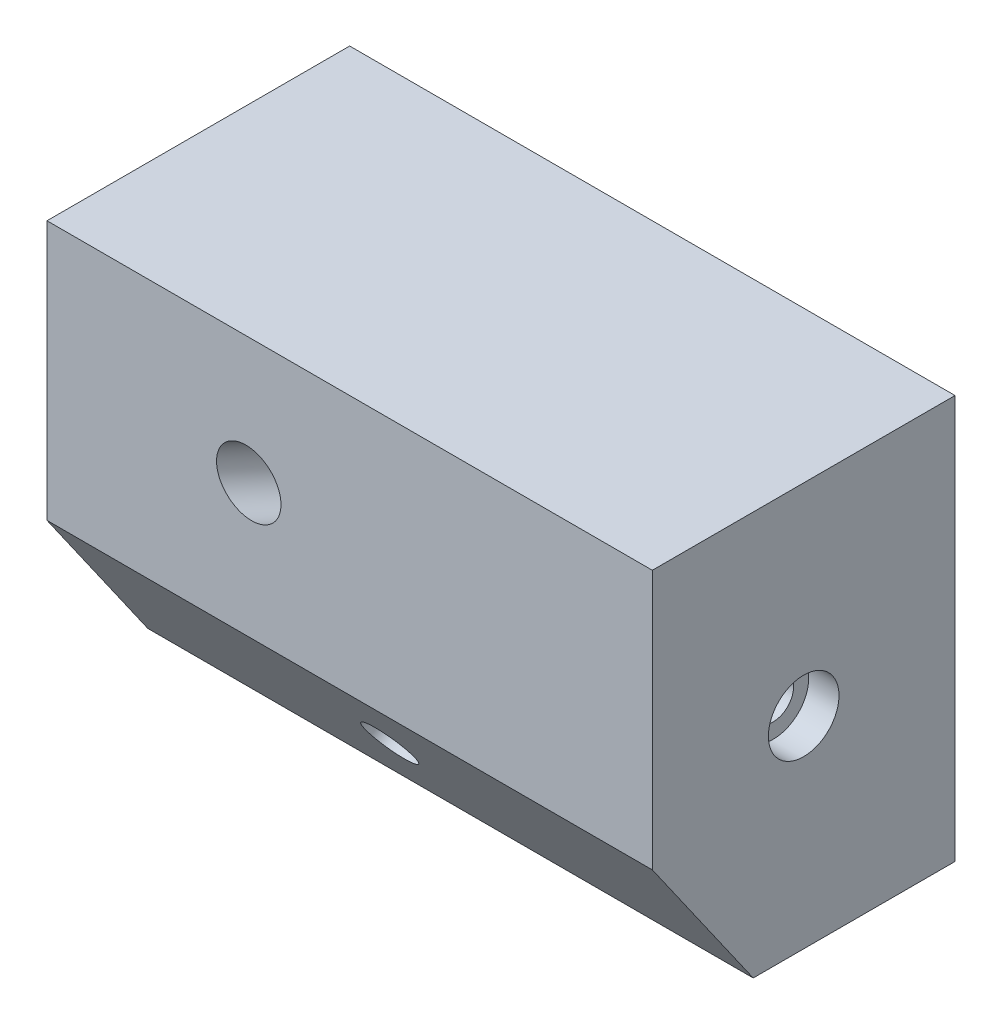
from build123d import *

# Parameters (mm, degrees)
SKETCH_1_W          = 120
SKETCH_1_H          = 80
EXTRUDE_1_DEPTH     = 60
CUT_EXTRUDE_1_DEPTH = 157.204993518
SWEEP_2_PROFILE_R   = 6
CUT_EXTRUDE_2_DEPTH = 3.602159411
CUT_EXTRUDE_2_DRAFT = -59
SKETCH_5_R          = 7
CUT_EXTRUDE_3_DEPTH = 6
SKETCH_6_R          = 4
CUT_EXTRUDE_4_DEPTH = 50
SWEEP_4_PROFILE_R   = 5


with BuildPart() as part:
    # 草图1 → 凸台-拉伸1 (new body)
    with BuildSketch(Plane.XY):
        with Locations((60, 40)):
            Rectangle(SKETCH_1_W, SKETCH_1_H)
    extrude(amount=EXTRUDE_1_DEPTH)

    # 草图2 → 切除-拉伸1 (cut, through all)
    with BuildSketch(Plane(origin=(0, 0, 0), x_dir=(0, 0, -1), z_dir=(1, 0, 0))):
        Polygon((-40, 0), (-60, 0), (-60, 28.56287), align=None)
    extrude(amount=CUT_EXTRUDE_1_DEPTH, mode=Mode.SUBTRACT)

    # 切除-扫描2: sweep along a curve in space
    with BuildLine() as sweep_2_path:
        Line((36.683319, 57.441689, 69.112507), (58.926443, 41.066649, 8.000026))
    # 切除-扫描2 profile (on start of the path) → 切除-扫描2 (sweep, cut)
    with BuildSketch(Plane(origin=(36.683319, 57.441689, 69.112507), x_dir=(-0.9396926209151826, 0, -0.34202014297049077), z_dir=(0.3316681247446686, -0.24416888605300846, -0.9112506845605045))):
        Circle(SWEEP_2_PROFILE_R)
    sweep(path=sweep_2_path.line, mode=Mode.SUBTRACT)


with BuildPart() as cut_extrude_2_tool:
    # 草图4 → 切除-拉伸2 (with draft: the straight prism first)
    with BuildSketch(Plane(origin=(0.738557167, -0.543714235, -2.029169141), x_dir=(0.9433961283725703, 0.08584202767282707, 0.3203668073578514), z_dir=(-0.3316681247446686, 0.2441688860530088, 0.9112506845605044))):
        with BuildLine():
            ThreePointArc((61.679165391, 31.596777759), (67.679165393, 37.596777757), (61.679165395, 43.596777759))
            ThreePointArc((61.679165395, 43.596777759), (55.679165393, 37.596777761), (61.679165391, 31.596777759))
        make_face()
    extrude(amount=-CUT_EXTRUDE_2_DEPTH)
    # 切除-拉伸2: the draft: its side faces are tilted about the plane it starts from
    cut_extrude_2_sides = [cut_extrude_2_tool.faces().sort_by_distance(p)[0] for p in [
        (59.523803726, 34.831326418, 7.911705161),
    ]]
    draft(cut_extrude_2_sides, Plane(origin=(0.738557167, -0.543714235, -2.029169141), x_dir=(0.9433961283725703, 0.08584202767282707, 0.3203668073578514), z_dir=(-0.3316681247446686, 0.2441688860530088, 0.9112506845605044)), CUT_EXTRUDE_2_DRAFT)


with BuildPart() as part_1:
    add(part.part)

    # 切除-拉伸2: cut by cut_extrude_2_tool
    add(cut_extrude_2_tool.part, mode=Mode.SUBTRACT)

    # 草图5 → 切除-拉伸3 (cut)
    with BuildSketch(Plane(origin=(120, 0, 0), x_dir=(0, 0, -1), z_dir=(1, 0, 0))):
        with Locations((-30, 40)):
            Circle(SKETCH_5_R)
    extrude(amount=-CUT_EXTRUDE_3_DEPTH, mode=Mode.SUBTRACT)

    # 草图6 → 切除-拉伸4 (cut)
    with BuildSketch(Plane(origin=(120, 0, 0), x_dir=(0, 0, -1), z_dir=(1, 0, 0))):
        with Locations((-30, 40)):
            Circle(SKETCH_6_R)
    extrude(amount=-CUT_EXTRUDE_4_DEPTH, mode=Mode.SUBTRACT)

    # 切除-扫描4: sweep along a curve in space
    with BuildLine() as sweep_4_path:
        Line((57.9403, 8.545716, 58.19152), (57.9403, 41.792672, 10.709946))
    # 切除-扫描4 profile (on start of the path) → 切除-扫描4 (sweep, cut)
    with BuildSketch(Plane(origin=(57.9403, 8.545716, 58.19152), x_dir=(0, -0.8191520446202117, -0.573576435878015), z_dir=(0, 0.573576435878015, -0.8191520446202117))):
        Circle(SWEEP_4_PROFILE_R)
    sweep(path=sweep_4_path.line, mode=Mode.SUBTRACT)


solid = part_1.part
